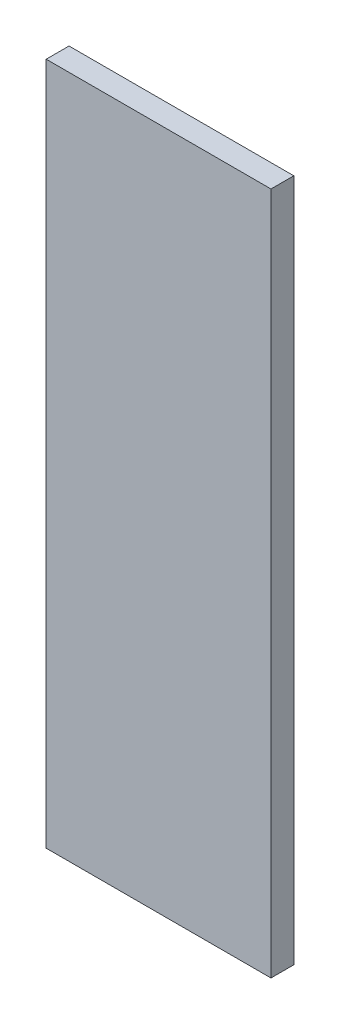
from build123d import *

# Parameters (mm, degrees)
SKETCH1_W           = 125
SKETCH1_H           = 380
BOSS_EXTRUDE1_DEPTH = 6.35


with BuildPart() as part:
    # Sketch1 → Boss-Extrude1 (new, symmetric)
    with BuildSketch(Plane.XY):
        Rectangle(SKETCH1_W, SKETCH1_H)
    extrude(amount=BOSS_EXTRUDE1_DEPTH, both=True)


solid = part.part
